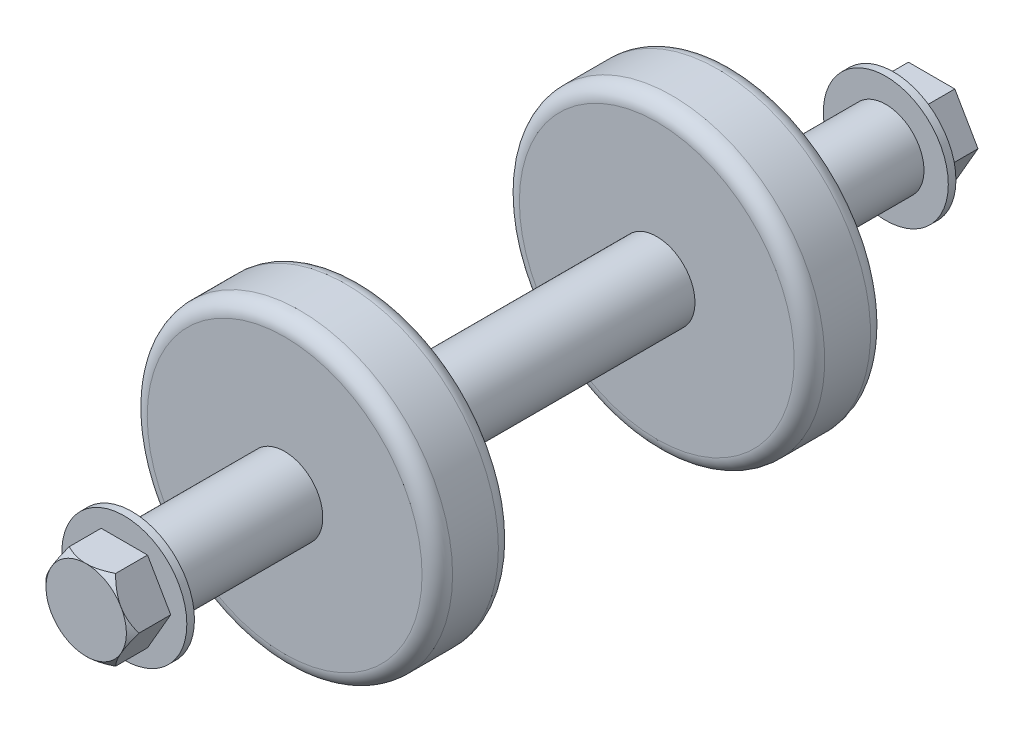
from build123d import *

# Parameters (mm, degrees)
SKETCH2_R           = 25
BOSS_EXTRUDE1_DEPTH = 246.875
SKETCH3_R           = 100
BOSS_EXTRUDE2_DEPTH = 50
FILLET1_R           = 10
SKETCH4_R           = 40.935
BOSS_EXTRUDE3_DEPTH = 5
BOSS_EXTRUDE4_DEPTH = 25
SKETCH6_R           = 40.935
SKETCH6_R_2         = 26.31
CUT_EXTRUDE1_DEPTH  = 25
CUT_EXTRUDE1_TAPER  = 45


with BuildPart() as part:
    # Sketch2 → Boss-Extrude1 (new, symmetric)
    with BuildSketch(Plane.XY):
        with Locations(Location((0, 0, 0), (0, 0, 180))):
            Circle(SKETCH2_R)
    extrude(amount=BOSS_EXTRUDE1_DEPTH, both=True)

    # Sketch3 → Boss-Extrude2 (add)
    with BuildSketch(Plane.XY.offset(146.875)):
        Circle(SKETCH3_R)
    boss_extrude2 = extrude(amount=-BOSS_EXTRUDE2_DEPTH)

    # Mirror1: Boss-Extrude2 across plane
    add(boss_extrude2.mirror(Plane.XY))

    # Fillet1
    fillet1_edges = [part.edges().sort_by_distance(p)[0] for p in [
        (-100, 0, -146.875),
        (-100, 0, -96.875),
        (-100, 0, 96.875),
        (-100, 0, 146.875),
    ]]
    fillet(fillet1_edges, radius=FILLET1_R)

    # Sketch4 → Boss-Extrude3 (add)
    with BuildSketch(Plane.XY.offset(246.875)):
        Circle(SKETCH4_R)
    boss_extrude3 = extrude(amount=BOSS_EXTRUDE3_DEPTH)

    # Sketch5 → Boss-Extrude4 (add)
    with BuildSketch(Plane.XY.offset(251.875)):
        Polygon((30.380171165, 0), (15.190085582, 26.31), (-15.190085582, 26.31), (-30.380171165, 0), (-15.190085582, -26.31), (15.190085582, -26.31), align=None)
    boss_extrude4 = extrude(amount=BOSS_EXTRUDE4_DEPTH)

    # Sketch6 → Cut-Extrude1 (cut)
    with BuildSketch(Plane.XY.offset(276.875)):
        Circle(SKETCH6_R)
        Circle(SKETCH6_R_2, mode=Mode.SUBTRACT)
    extrude(amount=-CUT_EXTRUDE1_DEPTH, taper=CUT_EXTRUDE1_TAPER, mode=Mode.SUBTRACT)

    # Mirror2: Boss-Extrude3, Boss-Extrude4 across plane
    add(boss_extrude3.mirror(Plane.XY))
    add(boss_extrude4.mirror(Plane.XY))


solid = part.part
